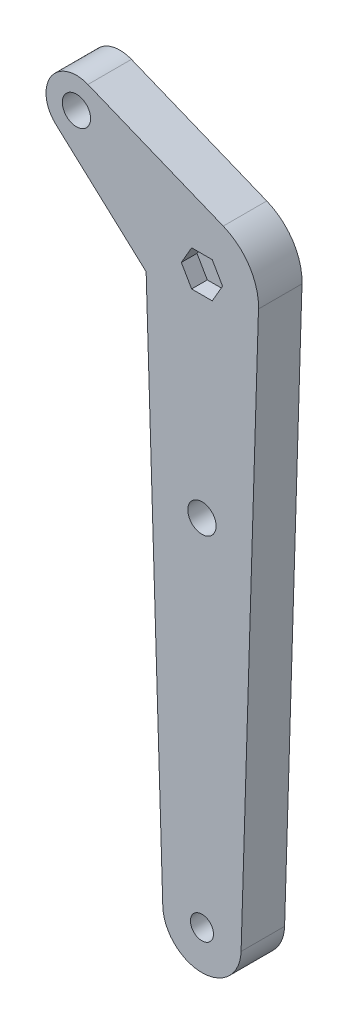
from build123d import *

# Parameters (mm, degrees)
SKETCH1_R           = 2.6
SKETCH1_R_2         = 2.65
BOSS_EXTRUDE1_DEPTH = 10
BOSS_EXTRUDE2_DEPTH = 10
CUT_EXTRUDE1_DEPTH  = 3.6
SKETCH4_R           = 3.25
CUT_EXTRUDE2_DEPTH  = 50
SKETCH5_R           = 2.05
CUT_EXTRUDE3_DEPTH  = 6.7


with BuildPart() as part:
    # Sketch1 → Boss-Extrude1 (new body)
    with BuildSketch(Plane.XY.offset(348)):
        with BuildLine():
            Line((287.006155303, 169.6), (291.004261364, 39.723076923))
            ThreePointArc((291.004261364, 39.723076923), (300, 31), (308.995738636, 39.723076923))
            Line((308.995738636, 39.723076923), (312.993844697, 169.6))
            ThreePointArc((312.993844697, 169.6), (300, 183), (287.006155303, 169.6))
        make_face()
        with Locations((300, 170)):
            Circle(SKETCH1_R, mode=Mode.SUBTRACT)
        with Locations((300, 40)):
            Circle(SKETCH1_R_2, mode=Mode.SUBTRACT)
    extrude(amount=BOSS_EXTRUDE1_DEPTH)

    # Sketch2 → Boss-Extrude2 (add)
    with BuildSketch(Plane.XY.offset(348)):
        with BuildLine():
            Line((304.894163453, 182.043552802), (273.797189857, 194.680494259))
            ThreePointArc((273.797189857, 194.680494259), (265.241776322, 191.9308059), (266.443148538, 183.025044191))
            Line((266.443148538, 183.025044191), (291.236658146, 160.397716962))
            ThreePointArc((291.236658146, 160.397716962), (310.994461682, 163.063011293), (304.894163453, 182.043552802))
        make_face()
    extrude(amount=BOSS_EXTRUDE2_DEPTH)

    # Sketch3 → Cut-Extrude1 (cut)
    with BuildSketch(Plane.XY.offset(354.4)):
        Polygon((304.734272207, 170), (302.367136104, 174.1), (297.632863896, 174.1), (295.265727793, 170), (297.632863896, 165.9), (302.367136104, 165.9), align=None)
    extrude(amount=CUT_EXTRUDE1_DEPTH, mode=Mode.SUBTRACT)

    # Sketch4 → Cut-Extrude2 (cut)
    with BuildSketch(Plane.XY.offset(348)):
        with Locations((300, 121.5)):
            Circle(SKETCH4_R)
        with Locations((271.161871074, 188.195504288)):
            Circle(SKETCH4_R)
    extrude(amount=CUT_EXTRUDE2_DEPTH, mode=Mode.SUBTRACT)

    # Sketch5 → Cut-Extrude3 (cut)
    with BuildSketch(Plane.XY.offset(348)):
        with Locations((300, 70)):
            Circle(SKETCH5_R)
    extrude(amount=CUT_EXTRUDE3_DEPTH, mode=Mode.SUBTRACT)


solid = part.part
